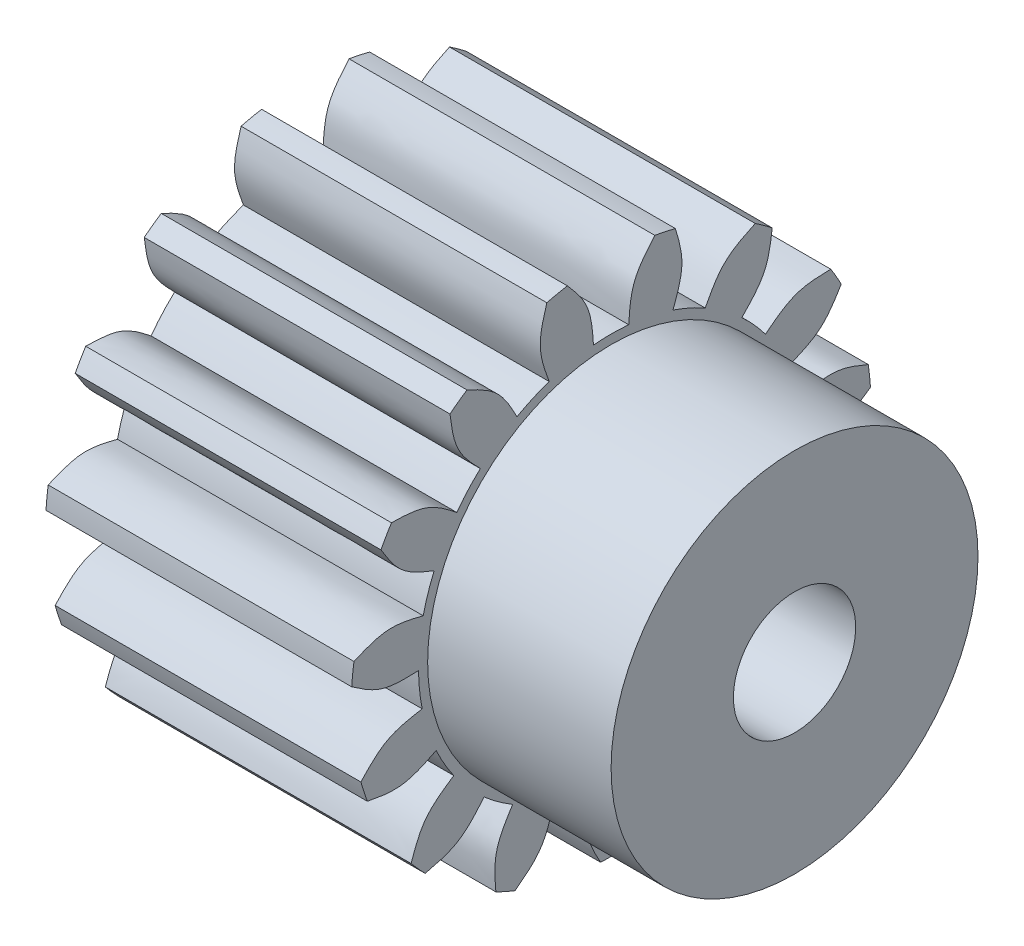
from build123d import *

# Parameters (mm, degrees)
KUGGLUCKA_DEPTH  = 25
CIRPATTERN_COUNT = 15


with BuildPart() as part:
    # Ritning 1 → Kugghjulsämne (revolve)
    with BuildSketch(Plane.XY, mode=Mode.PRIVATE) as kugghjuls_mne_sk:
        Polygon((-20, -5.625), (20, -5.625), (20, 4.375), (5, 4.375), (5, 10.625), (-20, 10.625), align=None)
    revolve(kugghjuls_mne_sk.sketch.rotate(Axis((-20, -10.625, 0), (1, 0, 0)), 90), axis=Axis((-20, -10.625, 0), (1, 0, 0)))

    # Ritning 2 → Kugglucka (cut)
    with BuildSketch(Plane.ZY.offset(20)):
        with BuildLine():
            Line((3.574215437, 10.322254808), (0, 13.896470246))
            Line((0, 13.896470246), (-3.574215437, 10.322254808))
            add(Edge.make_bspline(
                [(-3.574215437, 10.322254808), (-2.94694424, 9.592902819), (-1.647621629, 8.082131184), (-1.511467175, 6.089559524), (-1.441043715, 5.058937421)],
                knots=[0, 0, 0, 0, 0.48276786, 1, 1, 1, 1], degree=3))
            ThreePointArc((-1.441043715, 5.058937421), (0, 5.125), (1.441043715, 5.058937421))
            add(Edge.make_bspline(
                [(3.574215437, 10.322254808), (2.94694424, 9.592902819), (1.647621629, 8.082131184), (1.511467175, 6.089559524), (1.441043715, 5.058937421)],
                knots=[0, 0, 0, 0, 0.48276786, 1, 1, 1, 1], degree=3))
        make_face()
    kugglucka = extrude(amount=-KUGGLUCKA_DEPTH, mode=Mode.SUBTRACT)

    # CirPattern: Kugglucka ×15 about axis
    cirpattern_axis = Axis((-20, -10.625, 0), (-1, 0, 0))
    for i in range(1, CIRPATTERN_COUNT):
        add(kugglucka.rotate(cirpattern_axis, i * 360 / CIRPATTERN_COUNT), mode=Mode.SUBTRACT)


solid = part.part
